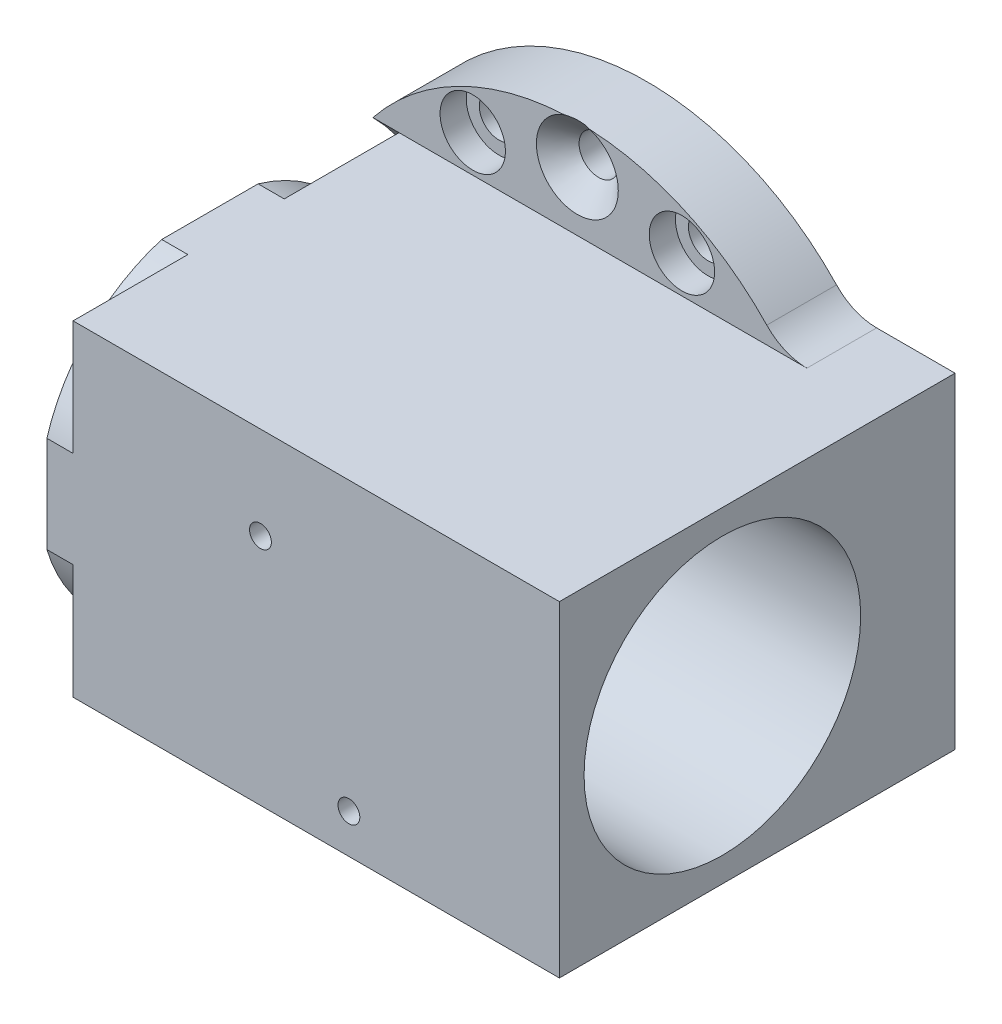
from build123d import *

# Parameters (mm, degrees)
BOSS_EXTRUDE1_DEPTH                                 = 8
CUT_EXTRUDE1_REACH                                  = 65.856
SKETCH4_W                                           = 55.8
SKETCH4_H                                           = 37.4
BOSS_EXTRUDE2_DEPTH                                 = 37.4
BOSS_EXTRUDE3_DEPTH                                 = 3
CUT_EXTRUDE2_START                                  = -3
CUT_EXTRUDE2_DEPTH                                  = 3
CUT_EXTRUDE3_START                                  = -3
CUT_EXTRUDE3_DEPTH                                  = 3
CSK_FOR_8_FLAT_HEAD_MACHINE_SCREW_100_D             = 4.5
CSK_FOR_8_FLAT_HEAD_MACHINE_SCREW_100_CSINK_D       = 9.4
CSK_FOR_8_FLAT_HEAD_MACHINE_SCREW_100_CSINK_ANGLE   = 90
F_4_CLEARANCE_HOLE1_D                               = 3.3
F_4_CLEARANCE_HOLE1_DEPTH                           = 6
CBORE_FOR_8_BINDING_HEAD_MACHINE_SCREW1_D           = 4.5
CBORE_FOR_8_BINDING_HEAD_MACHINE_SCREW1_CBORE_D     = 7.5
CBORE_FOR_8_BINDING_HEAD_MACHINE_SCREW1_CBORE_DEPTH = 3
FILLET1_R                                           = 6.35
M3X0_5_TAPPED_HOLE1_D                               = 2.5
M3X0_5_TAPPED_HOLE1_DEPTH                           = 4
M3X0_5_TAPPED_HOLE1_TIP                             = 0.751075774
FILLET2_R                                           = 6.35


with BuildPart() as part:
    # Sketch1 → Boss-Extrude1 (new body)
    with BuildSketch(Plane.XY.offset(8)):
        with BuildLine():
            Line((-23.45868709, 18.7), (-23.45868709, -18.7))
            ThreePointArc((-23.45868709, -18.7), (0, -30), (23.45868709, -18.7))
            Line((23.45868709, -18.7), (35.34131291, -18.7))
            Line((35.34131291, -18.7), (35.34131291, 18.7))
            Line((35.34131291, 18.7), (23.45868709, 18.7))
            ThreePointArc((23.45868709, 18.7), (0, 30), (-23.45868709, 18.7))
        make_face()
    extrude(amount=-BOSS_EXTRUDE1_DEPTH)

    # Sketch3 → Cut-Extrude1 (cut, up to next)
    with BuildSketch(Plane(origin=(-20.45868709, 0, 0), x_dir=(0, 0, -1), z_dir=(1, 0, 0)), mode=Mode.PRIVATE) as cut_extrude1_sk1:
        with BuildLine():
            Line((-8, 18.7), (-8, -18.7))
            ThreePointArc((-8, -18.7), (-0.254206384, 0), (-8, 18.7))
        make_face()
    cut_extrude1_tool1 = extrude(cut_extrude1_sk1.sketch, amount=-CUT_EXTRUDE1_REACH, mode=Mode.PRIVATE) & part.part
    add(cut_extrude1_tool1.solids().sort_by_distance((-20.458687, 0, 4.859168))[0], mode=Mode.SUBTRACT)

    # Sketch4 → Boss-Extrude2 (add)
    with BuildSketch(Plane.XY.offset(8)):
        with Locations((7.44131291, 0)):
            Rectangle(SKETCH4_W, SKETCH4_H)
    extrude(amount=BOSS_EXTRUDE2_DEPTH)

    # Sketch5 → Boss-Extrude3 (add)
    with BuildSketch(Plane.ZY.offset(20.45868709)):
        with BuildLine():
            Line((21.171890016, 18.7), (45.4, 18.7))
            Line((45.4, 18.7), (45.4, -18.7))
            Line((45.4, -18.7), (21.171890016, -18.7))
            ThreePointArc((21.171890016, -18.7), (7.2, 0), (21.171890016, 18.7))
        make_face()
    extrude(amount=BOSS_EXTRUDE3_DEPTH)

    # Sketch6 → Cut-Extrude2 (cut)
    with BuildSketch(Plane.ZY.offset(23.45868709).offset(CUT_EXTRUDE2_START)):
        with BuildLine():
            Line((45.4, -18.7), (45.4, -5.528109984))
            ThreePointArc((45.4, -5.528109984), (40.488582233, -13.788582233), (32.228109984, -18.7))
            Line((32.228109984, -18.7), (45.4, -18.7))
        make_face()
    extrude(amount=CUT_EXTRUDE2_DEPTH, mode=Mode.SUBTRACT)

    # Sketch7 → Cut-Extrude3 (cut)
    with BuildSketch(Plane.ZY.offset(23.45868709).offset(CUT_EXTRUDE3_START)):
        with BuildLine():
            Line((45.4, 18.7), (32.228109984, 18.7))
            ThreePointArc((32.228109984, 18.7), (40.488582233, 13.788582233), (45.4, 5.528109984))
            Line((45.4, 5.528109984), (45.4, 18.7))
        make_face()
    extrude(amount=CUT_EXTRUDE3_DEPTH, mode=Mode.SUBTRACT)

    # Sketch8 → Cut-Revolve1 (revolve, cut)
    with BuildSketch(Plane.XY.offset(26.7)):
        Polygon((-23.45868709, 15.86865), (-23.45868709, 0), (35.34131291, 0), (35.34131291, 15.86865), (9.94131291, 15.86865), (9.94131291, 13.5), (1.94131291, 13.5), (1.94131291, 15.86865), align=None)
    revolve(axis=Axis((-23.45868709, 0, 26.7), (1, 0, 0)), mode=Mode.SUBTRACT)

    # CSK for #8 Flat Head Machine Screw (100)1 (through all)
    with Locations(Plane.XY.offset(8)):
        with Locations((0, 25.5), (0, -25.5)):
            CounterSinkHole(CSK_FOR_8_FLAT_HEAD_MACHINE_SCREW_100_D / 2, CSK_FOR_8_FLAT_HEAD_MACHINE_SCREW_100_CSINK_D / 2, counter_sink_angle=CSK_FOR_8_FLAT_HEAD_MACHINE_SCREW_100_CSINK_ANGLE)

    # #4 Clearance Hole1
    with Locations(Plane(origin=(0, -18.7, 0), x_dir=(-1, 0, 0), z_dir=(0, -1, 0))):
        with Locations((12.45868709, -39.4), (-29.44131291, -39.4), (-29.44131291, -5.9)):
            Hole(F_4_CLEARANCE_HOLE1_D / 2, depth=F_4_CLEARANCE_HOLE1_DEPTH)

    # CBORE for #8 Binding Head Machine Screw1 (through all)
    with Locations(Plane.XY.offset(8)):
        with Locations((12, 22.95), (-12, 22.95), (-12, -22.95), (12, -22.95)):
            CounterBoreHole(CBORE_FOR_8_BINDING_HEAD_MACHINE_SCREW1_D / 2, CBORE_FOR_8_BINDING_HEAD_MACHINE_SCREW1_CBORE_D / 2, CBORE_FOR_8_BINDING_HEAD_MACHINE_SCREW1_CBORE_DEPTH)

    # Fillet1
    fillet1_edges = [part.edges().sort_by_distance(p)[0] for p in [
        (23.45868709, 18.7, 4),
    ]]
    fillet(fillet1_edges, radius=FILLET1_R)

    # M3x0.5 Tapped Hole1
    with Locations(Plane(origin=(1.04131291, 8.07366885, 45.4), x_dir=(1, 0, 0), z_dir=(0, 0, 1))):
        with Locations((0, 0), (10.150400418, -22.272670952)):
            Hole(M3X0_5_TAPPED_HOLE1_D / 2, depth=M3X0_5_TAPPED_HOLE1_DEPTH)
            with Locations((0, 0, -(M3X0_5_TAPPED_HOLE1_DEPTH + M3X0_5_TAPPED_HOLE1_TIP / 2))):  # 118° drill point
                Cone(0, M3X0_5_TAPPED_HOLE1_D / 2, M3X0_5_TAPPED_HOLE1_TIP, mode=Mode.SUBTRACT)

    # Fillet2
    fillet2_edges = [part.edges().sort_by_distance(p)[0] for p in [
        (23.45868709, -18.7, 4),
    ]]
    fillet(fillet2_edges, radius=FILLET2_R)


solid = part.part
